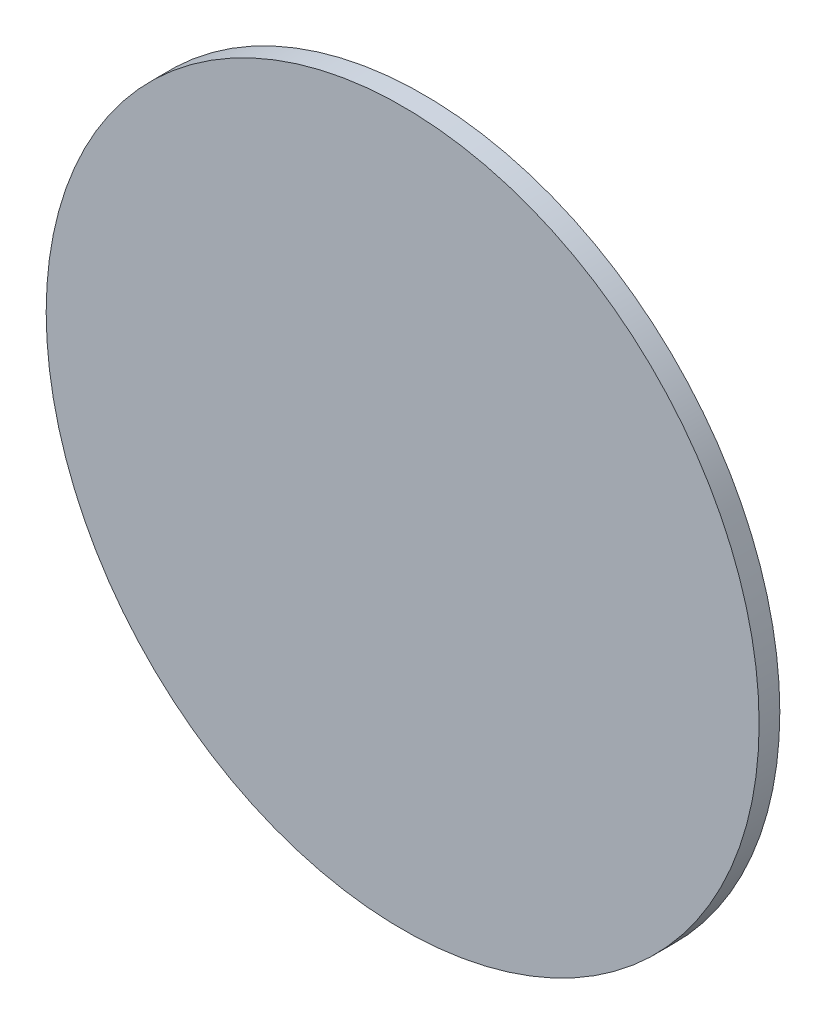
from build123d import *

# Parameters (mm, degrees)
SKETCH1_R           = 172.204
BOSS_EXTRUDE1_DEPTH = 10


with BuildPart() as part:
    # Sketch1 → Boss-Extrude1 (new body)
    with BuildSketch(Plane.XY):
        Circle(SKETCH1_R)
    extrude(amount=BOSS_EXTRUDE1_DEPTH)


solid = part.part
